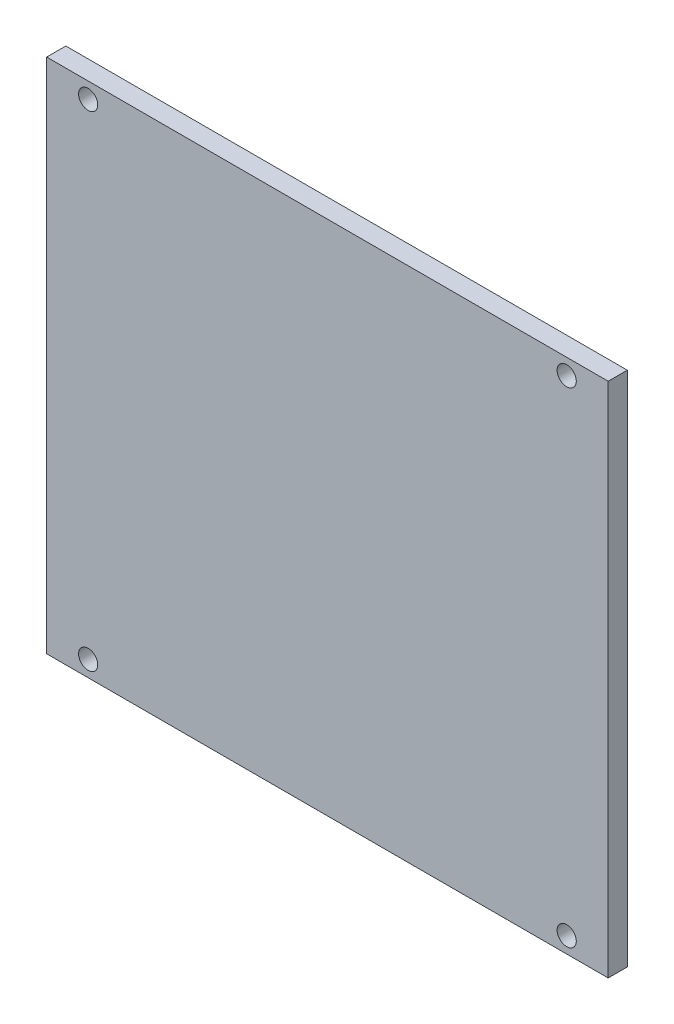
from build123d import *

# Parameters (mm, degrees)
SKETCH1_W           = 88
SKETCH1_H           = 81
BOSS_EXTRUDE1_DEPTH = 3
SKETCH2_R           = 3
SKETCH2_R_2         = 0.5
REGULATOR_DEPTH     = 3
SKETCH3_R           = 4
SKETCH3_R_2         = 1.5
ARDUIONO_DEPTH      = 3
SKETCH4_R           = 3
SKETCH4_R_2         = 0.5
SKETCH4_W           = 37.754434331
SKETCH4_H           = 4.20099223
RELAY_DEPTH         = 3
SKETCH5_R           = 1.5
CUT_EXTRUDE1_DEPTH  = 60.876957171


with BuildPart() as part:
    # Sketch1 → Boss-Extrude1 (new body)
    with BuildSketch(Plane.XY):
        Rectangle(SKETCH1_W, SKETCH1_H)
    extrude(amount=BOSS_EXTRUDE1_DEPTH)

    # Sketch2 → regulator (add)
    # profile 1 of 4: a face of its own
    with BuildSketch(Plane(origin=(0, 0, 0), x_dir=(-1, 0, 0), z_dir=(0, 0, -1))):
        with Locations((12.422333314, 20.490496054)):
            Circle(SKETCH2_R)
        with Locations((12.422333314, 20.490496054)):
            Circle(SKETCH2_R_2, mode=Mode.SUBTRACT)
    # profile 2 of 4: a face of its own
    with BuildSketch(Plane(origin=(0, 0, 0), x_dir=(-1, 0, 0), z_dir=(0, 0, -1))):
        with Locations((29.922333314, 20.490496054)):
            Circle(SKETCH2_R)
        with Locations((29.922333314, 20.490496054)):
            Circle(SKETCH2_R_2, mode=Mode.SUBTRACT)
    # profile 3 of 4: a face of its own
    with BuildSketch(Plane(origin=(0, 0, 0), x_dir=(-1, 0, 0), z_dir=(0, 0, -1))):
        with Locations((12.422333314, 34.290496054)):
            Circle(SKETCH2_R)
        with Locations((12.422333314, 34.290496054)):
            Circle(SKETCH2_R_2, mode=Mode.SUBTRACT)
    # profile 4 of 4: a face of its own
    with BuildSketch(Plane(origin=(0, 0, 0), x_dir=(-1, 0, 0), z_dir=(0, 0, -1))):
        with Locations((29.922333314, 34.290496054)):
            Circle(SKETCH2_R)
        with Locations((29.922333314, 34.290496054)):
            Circle(SKETCH2_R_2, mode=Mode.SUBTRACT)
    extrude(amount=REGULATOR_DEPTH)

    # Sketch3 → arduiono (add)
    # profile 1 of 2: a face of its own
    with BuildSketch(Plane(origin=(0, 0, 0), x_dir=(-1, 0, 0), z_dir=(0, 0, -1))):
        with Locations((-23, 24.859193612)):
            Circle(SKETCH3_R)
        with Locations((-23, 24.859193612)):
            Circle(SKETCH3_R_2, mode=Mode.SUBTRACT)
    # profile 2 of 2: a face of its own
    with BuildSketch(Plane(origin=(0, 0, 0), x_dir=(-1, 0, 0), z_dir=(0, 0, -1))):
        with Locations((-22.552178991, -17.138418896)):
            Circle(SKETCH3_R)
        with Locations((-22.552178991, -17.138418896)):
            Circle(SKETCH3_R_2, mode=Mode.SUBTRACT)
    extrude(amount=ARDUIONO_DEPTH)

    # Sketch4 → relay (add)
    # profile 1 of 5: a face of its own
    with BuildSketch(Plane(origin=(0, 0, 0), x_dir=(-1, 0, 0), z_dir=(0, 0, -1))):
        with Locations((36.272183711, -20.196025136)):
            Circle(SKETCH4_R)
        with Locations((36.272183711, -20.196025136)):
            Circle(SKETCH4_R_2, mode=Mode.SUBTRACT)
    # profile 2 of 5: a face of its own
    with BuildSketch(Plane(origin=(0, 0, 0), x_dir=(-1, 0, 0), z_dir=(0, 0, -1))):
        with Locations((22.672183711, -20.196025136)):
            Circle(SKETCH4_R)
        with Locations((22.672183711, -20.196025136)):
            Circle(SKETCH4_R_2, mode=Mode.SUBTRACT)
    # profile 3 of 5: a face of its own
    with BuildSketch(Plane(origin=(0, 0, 0), x_dir=(-1, 0, 0), z_dir=(0, 0, -1))):
        with Locations((12.678796965, -19.832402608)):
            Circle(SKETCH4_R)
        with Locations((12.678796965, -19.832402608)):
            Circle(SKETCH4_R_2, mode=Mode.SUBTRACT)
    # profile 4 of 5: a face of its own
    with BuildSketch(Plane(origin=(0, 0, 0), x_dir=(-1, 0, 0), z_dir=(0, 0, -1))):
        with Locations((-0.921203035, -19.832402608)):
            Circle(SKETCH4_R)
        with Locations((-0.921203035, -19.832402608)):
            Circle(SKETCH4_R_2, mode=Mode.SUBTRACT)
    # profile 5 of 5: a face of its own
    with BuildSketch(Plane(origin=(0, 0, 0), x_dir=(-1, 0, 0), z_dir=(0, 0, -1))):
        with Locations((17.631890713, -9.658418225)):
            Rectangle(SKETCH4_W, SKETCH4_H)
    extrude(amount=RELAY_DEPTH)

    # Sketch5 → Cut-Extrude1 (cut, through all)
    with BuildSketch(Plane(origin=(0, 0, 0), x_dir=(-1, 0, 0), z_dir=(0, 0, -1))):
        with Locations((-37.5, 38)):
            Circle(SKETCH5_R)
        with Locations((37.5, 38)):
            Circle(SKETCH5_R)
        with Locations((37.5, -38)):
            Circle(SKETCH5_R)
        with Locations((-37.5, -38)):
            Circle(SKETCH5_R)
    extrude(amount=-CUT_EXTRUDE1_DEPTH, mode=Mode.SUBTRACT)


solid = part.part
